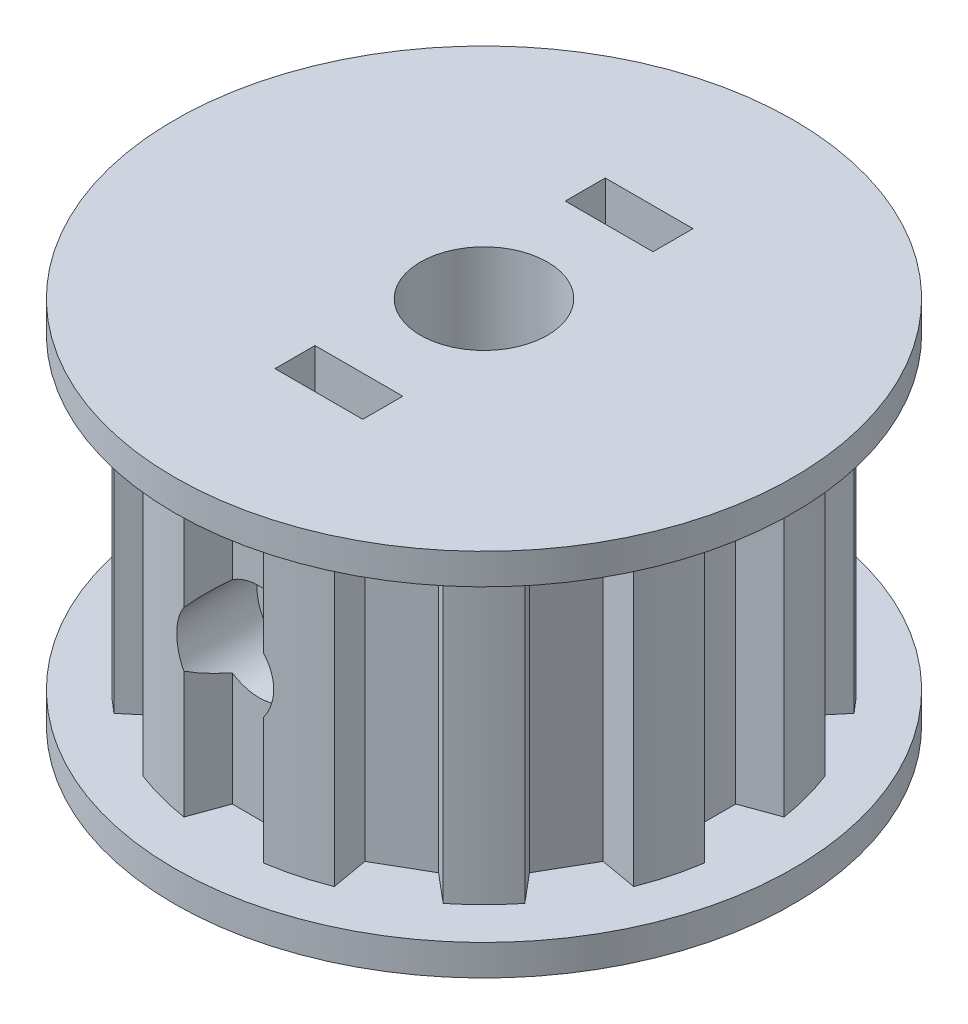
from build123d import *

# Parameters (mm, degrees)
SKETCH2_R               = 19.098593171
BOSS_EXTRUDE2_DEPTH     = 20
CUT_EXTRUDE1_START      = -20
CUT_EXTRUDE1_DEPTH      = 20
CIRPATTERN2_COUNT       = 12
SKETCH6_R               = 20.098593171
BOSS_EXTRUDE3_DEPTH     = 2
BOSS_EXTRUDE4_START     = 2
SKETCH7_R               = 20.098593171
BOSS_EXTRUDE4_DEPTH     = 2
CUT_EXTRUDE3_DEPTH      = 38.200899114
CUT_EXTRUDE3_DEPTH_BACK = 38.200899114
SKETCH8_R               = 4.125
SKETCH8_W               = 5.7
SKETCH8_H               = 2.6
CUT_EXTRUDE4_DEPTH      = 46.7367269
CUT_EXTRUDE4_DEPTH_BACK = 46.7367269
SKETCH10_R              = 1.5
CUT_EXTRUDE5_DEPTH      = 10
CUT_EXTRUDE5_DEPTH_BACK = 3
SKETCH11_R              = 3.175
CUT_EXTRUDE6_DEPTH      = 10
CUT_EXTRUDE6_DEPTH_BACK = 3
SKETCH12_R              = 3.15


with BuildPart() as part:
    # Sketch2 → Boss-Extrude2 (new body)
    with BuildSketch(Plane(origin=(0, 0, 0), x_dir=(1, 0, 0), z_dir=(0, 1, 0))):
        with Locations(Location((0, 0, 0), (0, 0, 270))):
            Circle(SKETCH2_R)
    extrude(amount=BOSS_EXTRUDE2_DEPTH)

    # Sketch3 → Cut-Extrude1 (cut)
    with BuildSketch(Plane(origin=(0, 20, 0), x_dir=(1, 0, 0), z_dir=(0, 1, 0)).offset(CUT_EXTRUDE1_START)):
        with BuildLine():
            Line((1.75, 14.598593171), (-1.75, 14.598593171))
            Line((-1.75, 14.598593171), (-2.588214639, 16.901568963))
            ThreePointArc((-2.588214639, 16.901568963), (-3.512123919, 16.734003526), (-4.425441557, 16.515972737))
            Line((-4.425441557, 16.515972737), (-4.943079647, 18.44782439))
            ThreePointArc((-4.943079647, 18.44782439), (0, 19.098593171), (4.943079647, 18.44782439))
            Line((4.943079647, 18.44782439), (4.425441557, 16.515972737))
            ThreePointArc((4.425441557, 16.515972737), (3.512123919, 16.734003526), (2.588214639, 16.901568963))
            Line((2.588214639, 16.901568963), (1.75, 14.598593171))
        make_face()
    cut_extrude1 = extrude(amount=CUT_EXTRUDE1_DEPTH, mode=Mode.SUBTRACT)

    # CirPattern2: Cut-Extrude1 ×12 about axis
    cirpattern2_axis = Axis((0, 0, 0), (0, 1, 0))
    for i in range(1, CIRPATTERN2_COUNT):
        add(cut_extrude1.rotate(cirpattern2_axis, i * 360 / CIRPATTERN2_COUNT), mode=Mode.SUBTRACT)

    # Sketch6 → Boss-Extrude3 (add)
    with BuildSketch(Plane(origin=(0, 20, 0), x_dir=(1, 0, 0), z_dir=(0, 1, 0))):
        with Locations(Location((0, 0, 0), (0, 0, 270))):
            Circle(SKETCH6_R)
    extrude(amount=BOSS_EXTRUDE3_DEPTH)

    # Sketch7 → Boss-Extrude4 (add)
    with BuildSketch(Plane.XZ.offset(BOSS_EXTRUDE4_START)):
        with Locations(Location((0, 0, 0), (0, 0, 90))):
            Circle(SKETCH7_R)
    extrude(amount=-BOSS_EXTRUDE4_DEPTH)

    # Sketch8 → Cut-Extrude3 (cut, two sides: drawn at the far end of the back side and taken through both)
    with BuildSketch(Plane.XZ.offset(2).offset(-CUT_EXTRUDE3_DEPTH_BACK)):
        with Locations(Location((0, 0, 0), (0, 0, 270))):
            Circle(SKETCH8_R)
        with Locations((0, 9.425)):
            Rectangle(SKETCH8_W, SKETCH8_H)
        with Locations((0, -9.425)):
            Rectangle(SKETCH8_W, SKETCH8_H)
    extrude(amount=CUT_EXTRUDE3_DEPTH + CUT_EXTRUDE3_DEPTH_BACK, mode=Mode.SUBTRACT)

    # Sketch10 → Cut-Extrude4 (cut, two sides: drawn at the far end of the back side and taken through both)
    with BuildSketch(Plane(origin=(0, 0, -14.598593171), x_dir=(-1, 0, 0), z_dir=(0, 0, -1)).offset(-CUT_EXTRUDE4_DEPTH_BACK)):
        with Locations((0, 10)):
            Circle(SKETCH10_R)
    extrude(amount=CUT_EXTRUDE4_DEPTH + CUT_EXTRUDE4_DEPTH_BACK, mode=Mode.SUBTRACT)

    # Sketch11 → Cut-Extrude5 (cut, two sides: drawn at the far end of the back side and taken through both)
    with BuildSketch(Plane(origin=(0, 0, -14.598593171), x_dir=(-1, 0, 0), z_dir=(0, 0, -1)).offset(-CUT_EXTRUDE5_DEPTH_BACK)):
        with Locations(Location((0, 10, 0), (0, 0, 144.605728901))):
            Circle(SKETCH11_R)
    extrude(amount=CUT_EXTRUDE5_DEPTH + CUT_EXTRUDE5_DEPTH_BACK, mode=Mode.SUBTRACT)

    # Sketch12 → Cut-Extrude6 (cut, two sides: drawn at the far end of the back side and taken through both)
    with BuildSketch(Plane.XY.offset(14.598593171).offset(-CUT_EXTRUDE6_DEPTH_BACK)):
        with Locations(Location((0, 10, 0), (0, 0, 145.250854713))):
            Circle(SKETCH12_R)
    extrude(amount=CUT_EXTRUDE6_DEPTH + CUT_EXTRUDE6_DEPTH_BACK, mode=Mode.SUBTRACT)


solid = part.part
